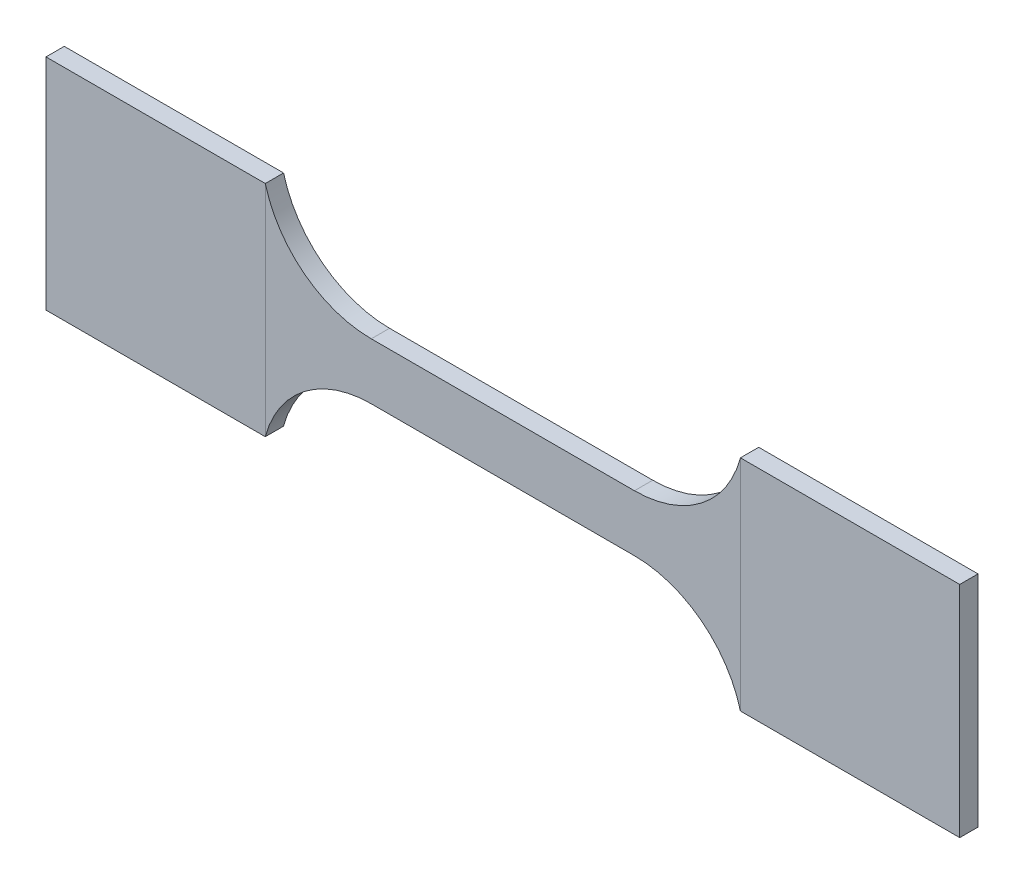
from build123d import *

# Parameters (mm, degrees)
BOSS_EXTRUDE1_DEPTH      = 2.5
SPLIT1_SURFACE_1_1_BACK  = 129.569
SPLIT1_SURFACE_1_1_DEPTH = 259.138
SPLIT1_SURFACE_1_2_BACK  = 129.569
SPLIT1_SURFACE_1_2_DEPTH = 259.138
SPLIT1_SURFACE_2_3_BACK  = 129.569
SPLIT1_SURFACE_2_3_DEPTH = 259.138
SPLIT1_SURFACE_2_4_BACK  = 129.569
SPLIT1_SURFACE_2_4_DEPTH = 259.138


with BuildPart() as part:
    # Sketch1 → Boss-Extrude1 (new body)
    with BuildSketch(Plane.XY):
        with BuildLine():
            Line((-87.188517058, 6.82308605), (-87.188517058, 36.82308605))
            Line((-87.188517058, 36.82308605), (-57.188517058, 36.82308605))
            ThreePointArc((-57.188517058, 36.82308605), (-51.835687852, 28.782964099), (-42.691017273, 25.67308605))
            Line((-42.691017273, 25.67308605), (-6.691017273, 25.67308605))
            ThreePointArc((-6.691017273, 25.67308605), (2.453653306, 28.782964099), (7.806482511, 36.82308605))
            Line((7.806482511, 36.82308605), (37.806482511, 36.82308605))
            Line((37.806482511, 36.82308605), (37.806482511, 6.82308605))
            Line((37.806482511, 6.82308605), (7.806482511, 6.82308605))
            ThreePointArc((7.806482511, 6.82308605), (2.453653306, 14.863208001), (-6.691017273, 17.97308605))
            Line((-6.691017273, 17.97308605), (-42.691017273, 17.97308605))
            ThreePointArc((-42.691017273, 17.97308605), (-51.835687852, 14.863208001), (-57.188517058, 6.82308605))
            Line((-57.188517058, 6.82308605), (-87.188517058, 6.82308605))
        make_face()
    extrude(amount=BOSS_EXTRUDE1_DEPTH)


with BuildPart() as body_2:
    # Split1: the piece behind the surface
    add(part.part)
    # Split1 surface 1: a surface, the sketch's curves swept straight by 259.138 mm
    with BuildLine(Plane.XY.offset(2.5).offset(-SPLIT1_SURFACE_1_1_BACK), mode=Mode.PRIVATE) as split1_surface_1_1_path:
        Line((-57.188517058, 36.82308605), (-57.188517058, 6.82308605))
    split1_surface_1_1 = Shell.extrude(split1_surface_1_1_path.wire(), (0 * SPLIT1_SURFACE_1_1_DEPTH, 0 * SPLIT1_SURFACE_1_1_DEPTH, 1 * SPLIT1_SURFACE_1_1_DEPTH))
    split(bisect_by=split1_surface_1_1, keep=Keep.BOTTOM)


with BuildPart() as part_1:
    add(part.part)

    # Split1: split by a surface, the side it looks to stays
    # Split1 surface 1: a surface, the sketch's curves swept straight by 259.138 mm
    with BuildLine(Plane.XY.offset(2.5).offset(-SPLIT1_SURFACE_1_2_BACK), mode=Mode.PRIVATE) as split1_surface_1_2_path:
        Line((-57.188517058, 36.82308605), (-57.188517058, 6.82308605))
    split1_surface_1_2 = Shell.extrude(split1_surface_1_2_path.wire(), (0 * SPLIT1_SURFACE_1_2_DEPTH, 0 * SPLIT1_SURFACE_1_2_DEPTH, 1 * SPLIT1_SURFACE_1_2_DEPTH))
    split(bisect_by=split1_surface_1_2, keep=Keep.TOP)


with BuildPart() as body_3:
    # Split1 2: the piece behind the surface
    add(part_1.part)
    # Split1 surface 2: a surface, the sketch's curves swept straight by 259.138 mm
    with BuildLine(Plane.XY.offset(2.5).offset(-SPLIT1_SURFACE_2_3_BACK), mode=Mode.PRIVATE) as split1_surface_2_3_path:
        Line((7.806482511, 36.82308605), (7.806482511, 6.82308605))
    split1_surface_2_3 = Shell.extrude(split1_surface_2_3_path.wire(), (0 * SPLIT1_SURFACE_2_3_DEPTH, 0 * SPLIT1_SURFACE_2_3_DEPTH, 1 * SPLIT1_SURFACE_2_3_DEPTH))
    split(bisect_by=split1_surface_2_3, keep=Keep.BOTTOM)


with BuildPart() as part_2:
    add(part_1.part)

    # Split1 2: split by a surface, the side it looks to stays
    # Split1 surface 2: a surface, the sketch's curves swept straight by 259.138 mm
    with BuildLine(Plane.XY.offset(2.5).offset(-SPLIT1_SURFACE_2_4_BACK), mode=Mode.PRIVATE) as split1_surface_2_4_path:
        Line((7.806482511, 36.82308605), (7.806482511, 6.82308605))
    split1_surface_2_4 = Shell.extrude(split1_surface_2_4_path.wire(), (0 * SPLIT1_SURFACE_2_4_DEPTH, 0 * SPLIT1_SURFACE_2_4_DEPTH, 1 * SPLIT1_SURFACE_2_4_DEPTH))
    split(bisect_by=split1_surface_2_4, keep=Keep.TOP)


solid = Compound([body_2.part, body_3.part, part_2.part])
